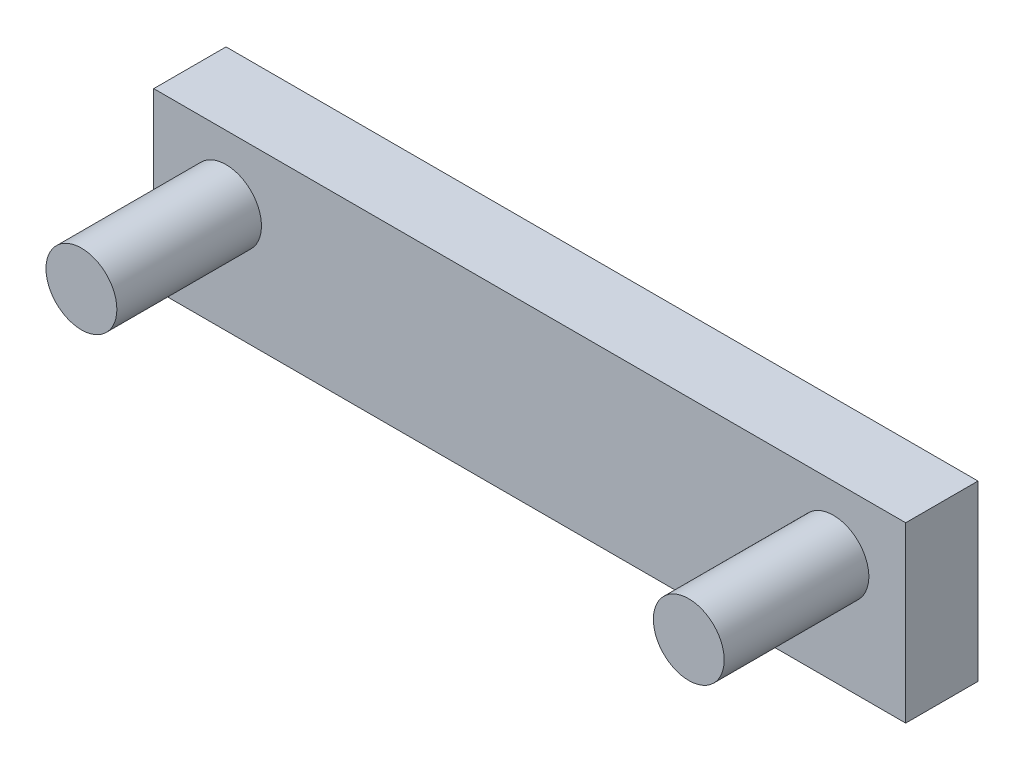
from build123d import *

# Parameters (mm, degrees)
SKETCH_3_R          = 2.45
EXTRUDE_2_DEPTH     = 10
EXTRUDE_2_2_DEPTH   = 10
SKETCH_4_W          = 52
SKETCH_4_H          = 15
EXTRUDE_3_DEPTH     = 5
SKETCH_5_W          = 52
SKETCH_5_H          = 3
CUT_EXTRUDE_1_DEPTH = 31.939457009


with BuildPart() as part:
    # 스케치3 → 보스-돌출2 (new body)
    with BuildSketch(Plane.XY):
        with Locations((-21, 0)):
            Circle(SKETCH_3_R)
    extrude(amount=EXTRUDE_2_DEPTH)



with BuildPart() as body_2:
    # 스케치3 → Extrude 2 2 (new body)
    with BuildSketch(Plane.XY):
        with Locations(Location((21, 0, 0), (0, 0, 180))):
            Circle(SKETCH_3_R)
    extrude(amount=EXTRUDE_2_2_DEPTH)


with BuildPart() as part_1:
    add(part.part)

    add(body_2.part)  # 보스-돌출3 merges body 2
    # 스케치4 → 보스-돌출3 (add)
    with BuildSketch(Plane.XY):
        Rectangle(SKETCH_4_W, SKETCH_4_H)
    extrude(amount=-EXTRUDE_3_DEPTH)

    # 스케치5 → 컷-돌출1 (cut, through all)
    with BuildSketch(Plane(origin=(0, 0, -5), x_dir=(-1, 0, 0), z_dir=(0, 0, -1))):
        with Locations((0, 6)):
            Rectangle(SKETCH_5_W, SKETCH_5_H)
    extrude(amount=-CUT_EXTRUDE_1_DEPTH, mode=Mode.SUBTRACT)


solid = part_1.part
